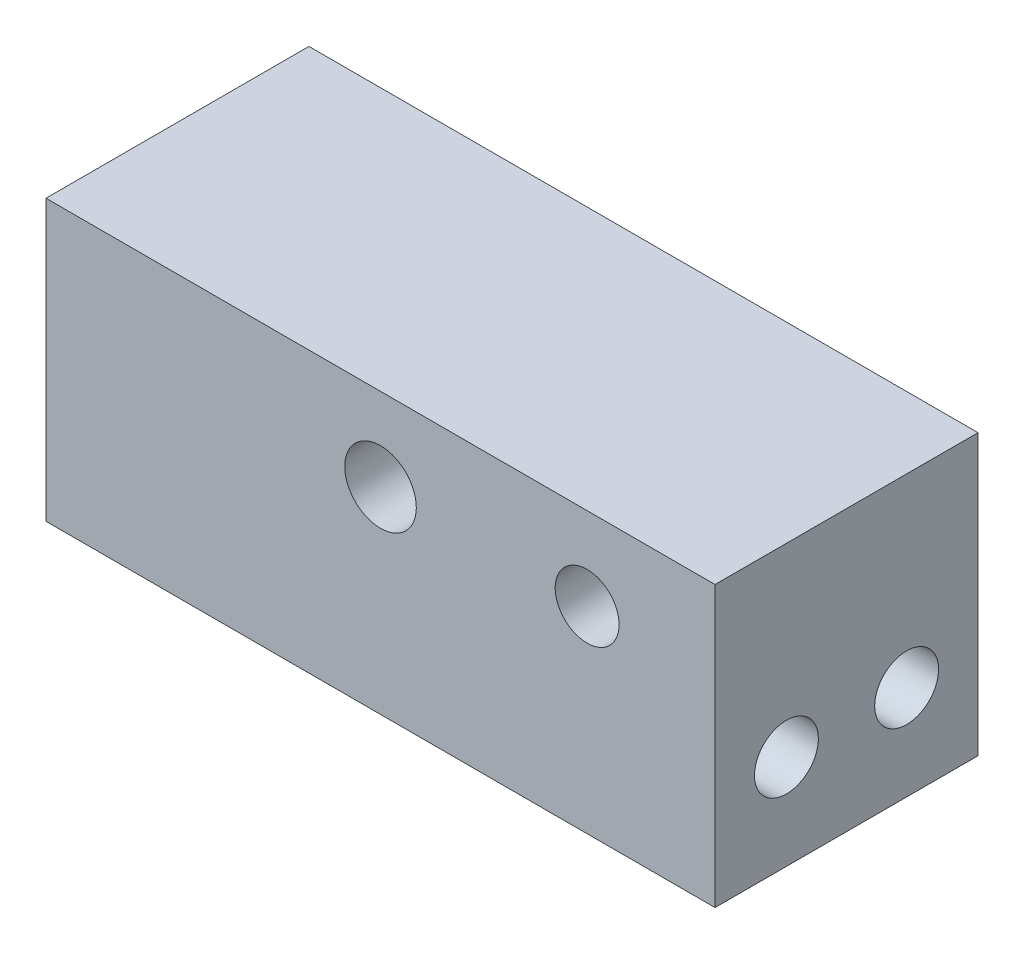
from build123d import *

# Parameters (mm, degrees)
SKETCH1_W           = 56.55
SKETCH1_H           = 22.225
BOSS_EXTRUDE1_DEPTH = 22.225
SKETCH2_R           = 2.7
SKETCH2_R_2         = 3.025
CUT_EXTRUDE1_DEPTH  = 10
SKETCH3_R           = 2.7
CUT_EXTRUDE2_DEPTH  = 8
SKETCH5_W           = 56.55
SKETCH5_H           = 22.225
BOSS_EXTRUDE2_DEPTH = 1.42494
SKETCH6_R           = 3.025
CUT_EXTRUDE3_DEPTH  = 10


with BuildPart() as part:
    # Sketch1 → Boss-Extrude1 (new body)
    with BuildSketch(Plane.XY):
        Rectangle(SKETCH1_W, SKETCH1_H)
    extrude(amount=BOSS_EXTRUDE1_DEPTH)

    # Sketch2 → Cut-Extrude1 (cut)
    with BuildSketch(Plane.XY.offset(22.225)):
        with Locations((17.4625, 4.1125)):
            Circle(SKETCH2_R)
        with Locations((0, 4.1125)):
            Circle(SKETCH2_R_2)
    extrude(amount=-CUT_EXTRUDE1_DEPTH, mode=Mode.SUBTRACT)

    # Sketch3 → Cut-Extrude2 (cut)
    with BuildSketch(Plane.ZY.offset(28.275)):
        with Locations(Location((16.1925, -4.5375001, 0), (0, 0, 270))):
            Circle(SKETCH3_R)
        with Locations(Location((6.0325, -4.5375001, 0), (0, 0, 270))):
            Circle(SKETCH3_R)
    cut_extrude2 = extrude(amount=-CUT_EXTRUDE2_DEPTH, mode=Mode.SUBTRACT)

    # Sketch5 → Boss-Extrude2 (add)
    with BuildSketch(Plane.XZ.offset(11.1125)):
        with Locations((0, 11.1125)):
            Rectangle(SKETCH5_W, SKETCH5_H)
    extrude(amount=BOSS_EXTRUDE2_DEPTH)

    # Mirror2: Cut-Extrude2 across plane
    add(cut_extrude2.mirror(Plane(origin=(0, 0, 0), x_dir=(0, 0, 1), z_dir=(1, 0, 0))), mode=Mode.SUBTRACT)

    # Sketch6 → Cut-Extrude3 (cut)
    with BuildSketch(Plane(origin=(0, 0, 0), x_dir=(-1, 0, 0), z_dir=(0, 0, -1))):
        with Locations((-10, 1.1125)):
            Circle(SKETCH6_R)
        with Locations((10, 1.1125)):
            Circle(SKETCH6_R)
    extrude(amount=-CUT_EXTRUDE3_DEPTH, mode=Mode.SUBTRACT)


solid = part.part
